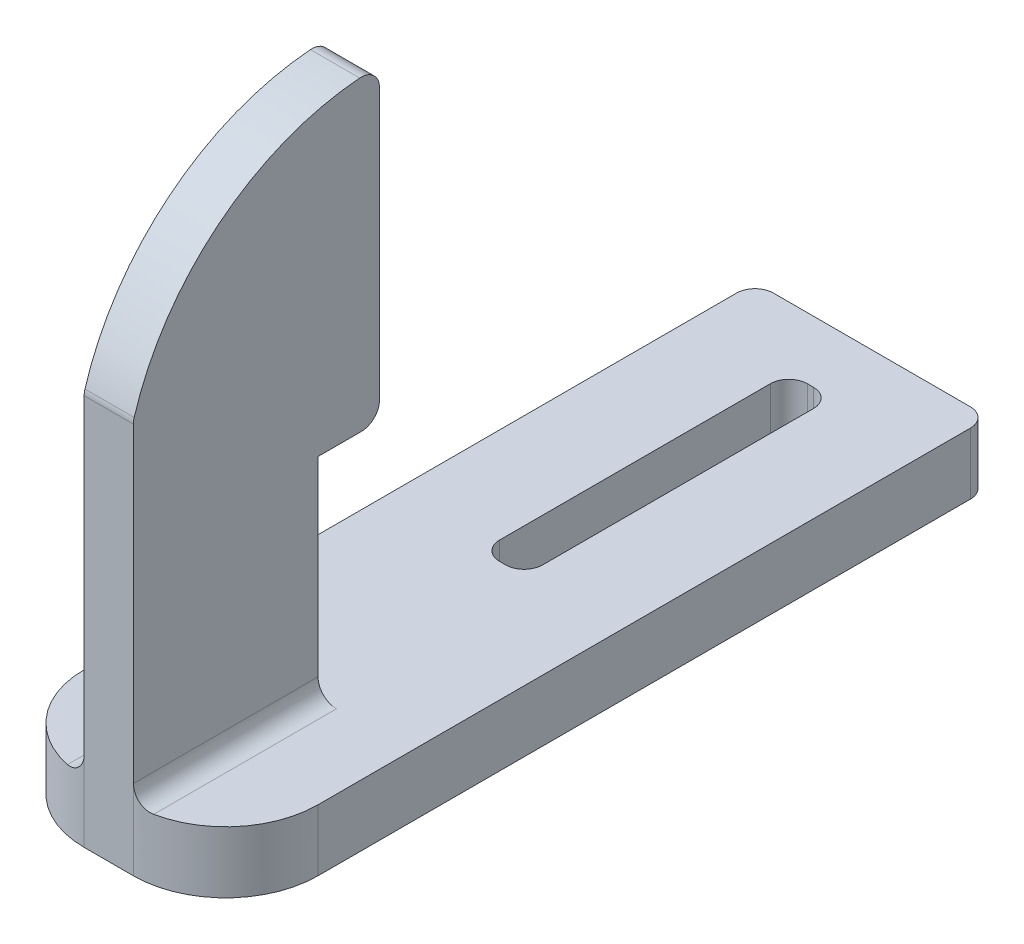
from build123d import *

# Parameters (mm, degrees)
SKETCH1_W           = 19
SKETCH1_H           = 62
SKETCH1_W_2         = 3.5
SKETCH1_H_2         = 25
BOSS_EXTRUDE1_DEPTH = 5
SKETCH4_W           = 4
SKETCH4_H           = 15
BOSS_EXTRUDE3_DEPTH = 17
BOSS_EXTRUDE4_DEPTH = 4
CUT_EXTRUDE1_DEPTH  = 78.259303647
FILLET1_R           = 1.5


with BuildPart() as part:
    # Sketch1 → Boss-Extrude1 (new body)
    with BuildSketch(Plane(origin=(0, 0, 0), x_dir=(1, 0, 0), z_dir=(0, 1, 0))):
        with Locations((-9.5, 31)):
            Rectangle(SKETCH1_W, SKETCH1_H)
        with Locations((-9.5, 44.5)):
            Rectangle(SKETCH1_W_2, SKETCH1_H_2, mode=Mode.SUBTRACT)
    extrude(amount=BOSS_EXTRUDE1_DEPTH)

    # Sketch4 → Boss-Extrude3 (add)
    with BuildSketch(Plane(origin=(0, 5, 0), x_dir=(1, 0, 0), z_dir=(0, 1, 0))):
        with Locations((-9.5, 7.5)):
            Rectangle(SKETCH4_W, SKETCH4_H)
    extrude(amount=BOSS_EXTRUDE3_DEPTH)

    # Sketch5 → Boss-Extrude4 (add)
    with BuildSketch(Plane(origin=(-7.5, 0, 0), x_dir=(0, 0, -1), z_dir=(1, 0, 0))):
        with BuildLine():
            Line((15, 22), (20, 22))
            Line((20, 22), (20, 47))
            ThreePointArc((20, 47), (7.5, 42.833333333), (0, 32))
            Line((0, 32), (0, 22))
            Line((0, 22), (15, 22))
        make_face()
    extrude(amount=-BOSS_EXTRUDE4_DEPTH)

    # Sketch6 → Cut-Extrude1 (cut, through all)
    with BuildSketch(Plane(origin=(0, 5, 0), x_dir=(1, 0, 0), z_dir=(0, 1, 0))):
        with BuildLine():
            Line((-19, 7.5), (-19, 0))
            Line((-19, 0), (-11.5, 0))
            ThreePointArc((-11.5, 0), (-16.803300859, 2.196699141), (-19, 7.5))
        make_face()
        with BuildLine():
            Line((0, 0), (-7.5, 0))
            ThreePointArc((-7.5, 0), (-2.196699141, 2.196699141), (0, 7.5))
            Line((0, 7.5), (0, 0))
        make_face()
    extrude(amount=-CUT_EXTRUDE1_DEPTH, mode=Mode.SUBTRACT)

    # Fillet1
    fillet1_edges = [part.edges().sort_by_distance(p)[0] for p in [
        (-11.25, 2.5, -57),
        (-11.25, 2.5, -32),
        (-7.75, 2.5, -32),
        (-7.75, 2.5, -57),
        (-11.5, 5, -7.5),
        (-7.5, 5, -7.5),
        (-9.5, 32, 0),
        (-9.5, 47, -20),
        (-9.5, 22, -20),
        (-19, 2.5, -62),
        (0, 2.5, -62),
    ]]
    fillet(fillet1_edges, radius=FILLET1_R)


solid = part.part
